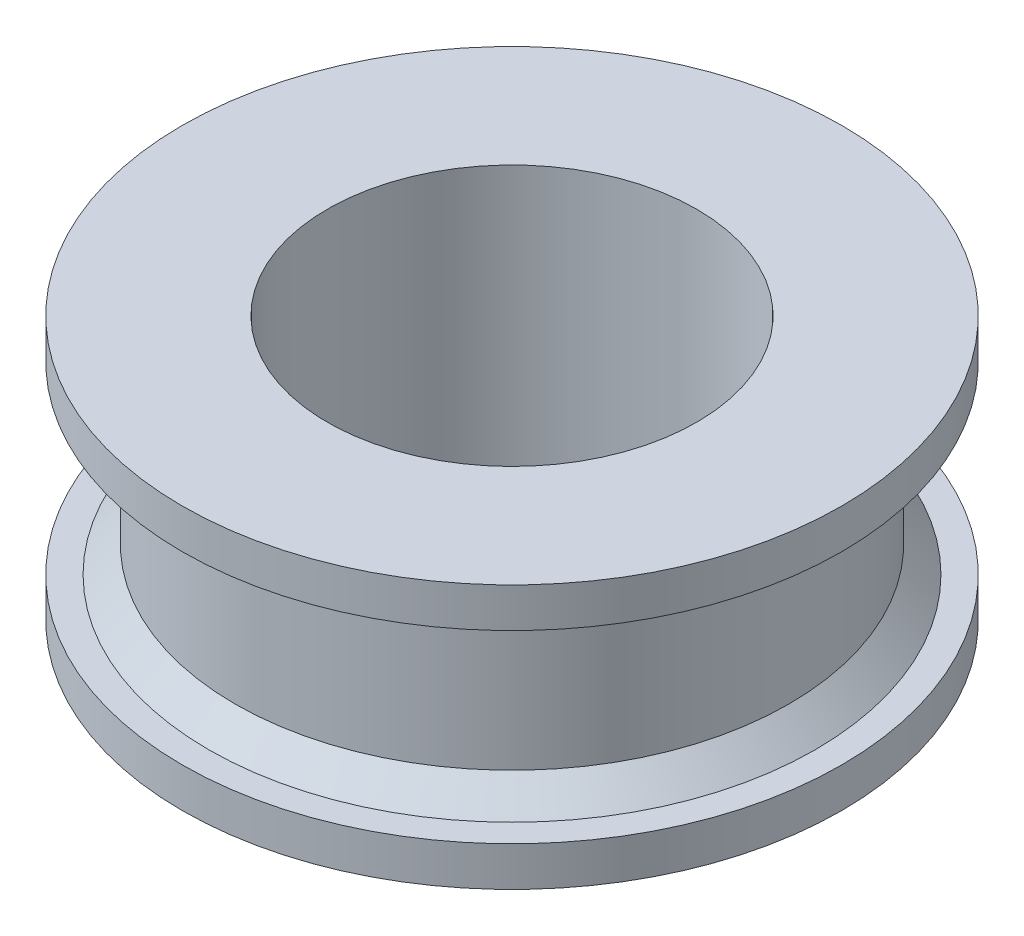
from build123d import *


with BuildPart() as part:
    # Sketch1 → Revolve1 (revolve)
    with BuildSketch(Plane.XY, mode=Mode.PRIVATE) as revolve1_sk:
        Polygon((7, -5), (7, 5), (12.5, 5), (12.5, 3.5), (11.5, 3.5), (10.5, 2.5), (10.5, -2.5), (11.5, -3.5), (12.5, -3.5), (12.5, -5), align=None)
    revolve(revolve1_sk.sketch.rotate(Axis((0, -14.844827586, 0), (0, 1, 0)), 90), axis=Axis((0, -14.844827586, 0), (0, 1, 0)))


solid = part.part
